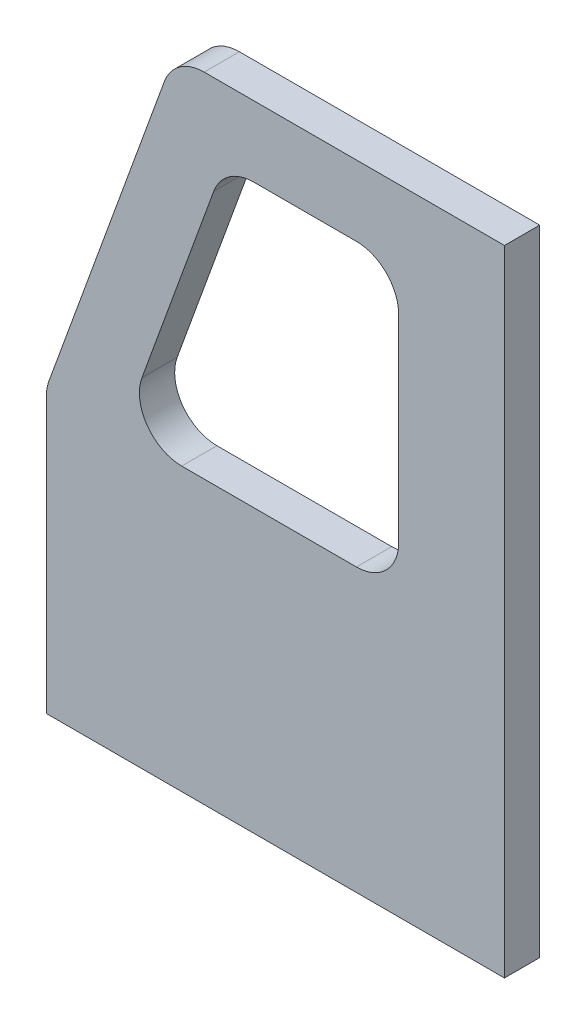
from build123d import *

# Parameters (mm, degrees)
BOSS_EXTRU_1_DEPTH           = 5
ENL_V_MAT_EXTRU_1_DEPTH      = 112.130553854
ENL_V_MAT_EXTRU_1_DEPTH_BACK = 112.130553854
CONG_1_R                     = 6


with BuildPart() as part:
    # Esquisse1 → Boss.-Extru.1 (new body)
    with BuildSketch(Plane.XY):
        Polygon((0, 0), (65, 0), (65, 90), (18.198511713, 90), (0, 40), align=None)
    extrude(amount=BOSS_EXTRU_1_DEPTH)

    # Esquisse2 → Enlèv. mat.-Extru.1 (cut, two sides: drawn at the far end of the back side and taken through both)
    with BuildSketch(Plane.XY.offset(5).offset(-ENL_V_MAT_EXTRU_1_DEPTH_BACK)):
        Polygon((10.641777725, 40), (25.200587095, 80), (50, 80), (50, 40), align=None)
    extrude(amount=ENL_V_MAT_EXTRU_1_DEPTH + ENL_V_MAT_EXTRU_1_DEPTH_BACK, mode=Mode.SUBTRACT)

    # Congé1
    cong_1_edges = [part.edges().sort_by_distance(p)[0] for p in [
        (50, 40, 2.5),
        (10.641777725, 40, 2.5),
        (25.200587095, 80, 2.5),
        (50, 80, 2.5),
        (0, 40, 2.5),
        (18.198511713, 90, 2.5),
    ]]
    fillet(cong_1_edges, radius=CONG_1_R)


solid = part.part
